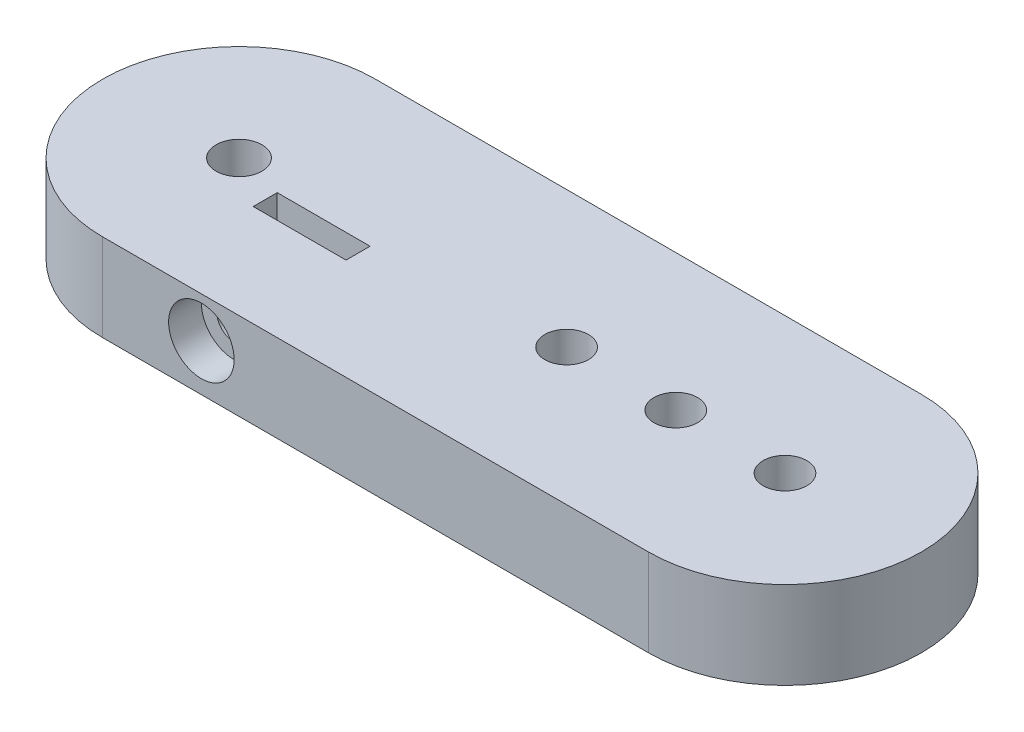
from build123d import *

# Parameters (mm, degrees)
SKETCH_1_R          = 2.1
SKETCH_1_R_2        = 2
SKETCH_1_W          = 8.5
SKETCH_1_H          = 2.2
EXTRUDE_1_DEPTH     = 8
CUT_EXTRUDE_START   = -8
SKETCH_2_R          = 2
CUT_EXTRUDE_2_DEPTH = 8
SKETCH_3_R          = 1.6
CUT_EXTRUDE_3_DEPTH = 10
SKETCH_4_R          = 3
CUT_EXTRUDE_4_DEPTH = 3


with BuildPart() as part:
    # 草图1 → 凸台-拉伸1 (new body)
    with BuildSketch(Plane(origin=(0, 0, 0), x_dir=(1, 0, 0), z_dir=(0, 1, 0))):
        with BuildLine():
            Line((0, 12.5), (50, 12.5))
            ThreePointArc((50, 12.5), (62.5, 0), (50, -12.5))
            Line((50, -12.5), (0, -12.5))
            ThreePointArc((0, -12.5), (-12.5, 0), (0, 12.5))
        make_face()
        with Locations(Location((0, 0, 0), (0, 0, 270))):
            Circle(SKETCH_1_R, mode=Mode.SUBTRACT)
        with Locations(Location((50, 0, 0), (0, 0, 270))):
            Circle(SKETCH_1_R_2, mode=Mode.SUBTRACT)
        with Locations((8.75, -2.1)):
            Rectangle(SKETCH_1_W, SKETCH_1_H, mode=Mode.SUBTRACT)
    extrude(amount=EXTRUDE_1_DEPTH)

    # 草图2 → 切除-拉伸2 (cut)
    with BuildSketch(Plane(origin=(0, 8, 0), x_dir=(1, 0, 0), z_dir=(0, 1, 0)).offset(CUT_EXTRUDE_START)):
        with Locations(Location((40, 0, 0), (0, 0, 270))):
            Circle(SKETCH_2_R)
        with Locations(Location((30, 0, 0), (0, 0, 270))):
            Circle(SKETCH_2_R)
        with Locations(Location((50, 0, 0), (0, 0, 270))):
            Circle(SKETCH_2_R)
    extrude(amount=CUT_EXTRUDE_2_DEPTH, mode=Mode.SUBTRACT)

    # 草图3 → 切除-拉伸3 (cut)
    with BuildSketch(Plane.XY.offset(12.5)):
        with Locations((9.051883486, 4.271448274)):
            Circle(SKETCH_3_R)
    extrude(amount=-CUT_EXTRUDE_3_DEPTH, mode=Mode.SUBTRACT)

    # 草图4 → 切除-拉伸4 (cut)
    with BuildSketch(Plane.XY.offset(12.5)):
        with Locations((9.051883486, 4.271448274)):
            Circle(SKETCH_4_R)
    extrude(amount=-CUT_EXTRUDE_4_DEPTH, mode=Mode.SUBTRACT)


solid = part.part
